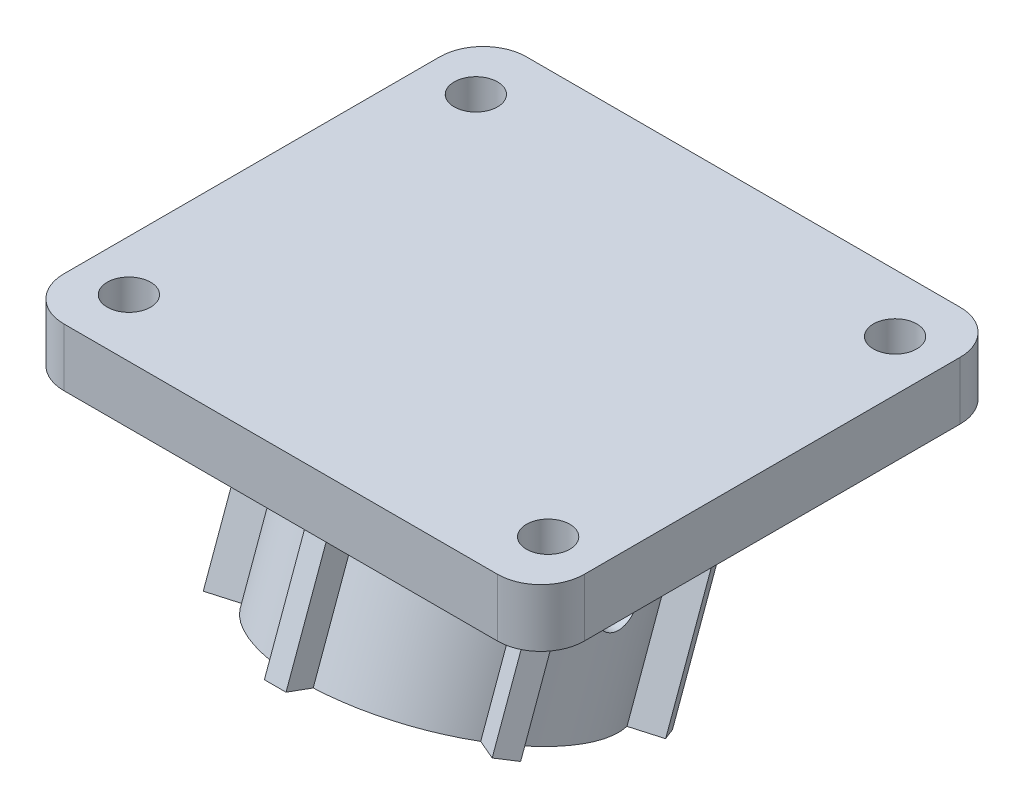
from build123d import *

# Parameters (mm, degrees)
IZIM2_R                     = 1.5
Y_KSEKLIK_EKSTR_ZYON1_DEPTH = 4
Y_KSEKLIK_EKSTR_ZYON2_REACH = 35.135
IZIM4_R                     = 8
KES_EKSTR_ZYON1_REACH       = 45.534
IZIM5_R                     = 1.5


with BuildPart() as part:
    # Çizim2 → Yükseklik-Ekstrüzyon1 (new body)
    with BuildSketch(Plane(origin=(0, 0, 0), x_dir=(1, 0, 0), z_dir=(0, 1, 0))):
        with BuildLine():
            Line((15, -16), (-15, -16))
            ThreePointArc((-15, -16), (-17.121320344, -15.121320344), (-18, -13))
            Line((-18, -13), (-18, 13))
            ThreePointArc((-18, 13), (-17.121320344, 15.121320344), (-15, 16))
            Line((-15, 16), (15, 16))
            ThreePointArc((15, 16), (17.121320344, 15.121320344), (18, 13))
            Line((18, 13), (18, -13))
            ThreePointArc((18, -13), (17.121320344, -15.121320344), (15, -16))
        make_face()
        with Locations(Location((14.5, -12, 0), (0, 0, 270))):
            Circle(IZIM2_R, mode=Mode.SUBTRACT)
        with Locations(Location((-14.5, -12, 0), (0, 0, 270))):
            Circle(IZIM2_R, mode=Mode.SUBTRACT)
        with Locations(Location((14.5, 12, 0), (0, 0, 270))):
            Circle(IZIM2_R, mode=Mode.SUBTRACT)
        with Locations(Location((-14.5, 12, 0), (0, 0, 270))):
            Circle(IZIM2_R, mode=Mode.SUBTRACT)
    extrude(amount=Y_KSEKLIK_EKSTR_ZYON1_DEPTH)

    # Yükseklik-Ekstrüzyon2: up to this plane
    y_kseklik_ekstr_zyon2_end = Plane(origin=(15, 0, -13), z_dir=(0, 1, 0))
    # Çizim4 → Yükseklik-Ekstrüzyon2 (add, up to the surface)
    with BuildSketch(Plane(origin=(0, -14.095389312, 5.13030215), x_dir=(-1, 0, 0), z_dir=(0, -0.9396926207859094, 0.34202014332566627)), mode=Mode.PRIVATE) as y_kseklik_ekstr_zyon2_sk1:
        with BuildLine():
            Line((-0.75, 11.971835338), (-0.75, 9.971835338))
            ThreePointArc((-0.75, 9.971835338), (-5, 8.660254038), (-8.260862725, 5.635436722))
            Line((-8.260862725, 5.635436722), (-9.992913532, 6.635436722))
            Line((-9.992913532, 6.635436722), (-10.742913532, 5.336398616))
            Line((-10.742913532, 5.336398616), (-9.010862725, 4.336398616))
            ThreePointArc((-9.010862725, 4.336398616), (-10, 0), (-9.010862725, -4.336398616))
            Line((-9.010862725, -4.336398616), (-10.742913532, -5.336398616))
            Line((-10.742913532, -5.336398616), (-9.992913532, -6.635436722))
            Line((-9.992913532, -6.635436722), (-8.260862725, -5.635436722))
            ThreePointArc((-8.260862725, -5.635436722), (-5, -8.660254038), (-0.75, -9.971835338))
            Line((-0.75, -9.971835338), (-0.75, -11.971835338))
            Line((-0.75, -11.971835338), (0.75, -11.971835338))
            Line((0.75, -11.971835338), (0.75, -9.971835338))
            ThreePointArc((0.75, -9.971835338), (5, -8.660254038), (8.260862725, -5.635436722))
            Line((8.260862725, -5.635436722), (9.992913532, -6.635436722))
            Line((9.992913532, -6.635436722), (10.742913532, -5.336398616))
            Line((10.742913532, -5.336398616), (9.010862725, -4.336398616))
            ThreePointArc((9.010862725, -4.336398616), (10, 0), (9.010862725, 4.336398616))
            Line((9.010862725, 4.336398616), (10.742913532, 5.336398616))
            Line((10.742913532, 5.336398616), (9.992913532, 6.635436722))
            Line((9.992913532, 6.635436722), (8.260862725, 5.635436722))
            ThreePointArc((8.260862725, 5.635436722), (5, 8.660254038), (0.75, 9.971835338))
            Line((0.75, 9.971835338), (0.75, 11.971835338))
            Line((0.75, 11.971835338), (-0.75, 11.971835338))
        make_face()
        with Locations(Location((0, 0, 0), (0, 0, 90))):
            Circle(IZIM4_R, mode=Mode.SUBTRACT)
    y_kseklik_ekstr_zyon2_tool1 = split(extrude(y_kseklik_ekstr_zyon2_sk1.sketch, amount=-Y_KSEKLIK_EKSTR_ZYON2_REACH, mode=Mode.PRIVATE), bisect_by=y_kseklik_ekstr_zyon2_end, keep=Keep.BOTH, mode=Mode.PRIVATE)
    add(y_kseklik_ekstr_zyon2_tool1.solids().sort_by_distance((-0.428295, -17.847978, -5.179851))[0])

    # Çizim5 → Kes-Ekstrüzyon1 (cut, up to next)
    with BuildSketch(Plane.ZY.offset(18), mode=Mode.PRIVATE) as kes_ekstr_zyon1_sk1:
        with Locations((2.565151075, -7.047694656)):
            Circle(IZIM5_R)
    kes_ekstr_zyon1_tool1 = extrude(kes_ekstr_zyon1_sk1.sketch, amount=-KES_EKSTR_ZYON1_REACH, mode=Mode.PRIVATE) & part.part
    add(kes_ekstr_zyon1_tool1.solids().sort_by_distance((-18, -7.047695, 2.565151))[0], mode=Mode.SUBTRACT)
    add(kes_ekstr_zyon1_tool1.solids().sort_by_distance((-18, -7.047695, 2.565151))[1], mode=Mode.SUBTRACT)


solid = part.part
